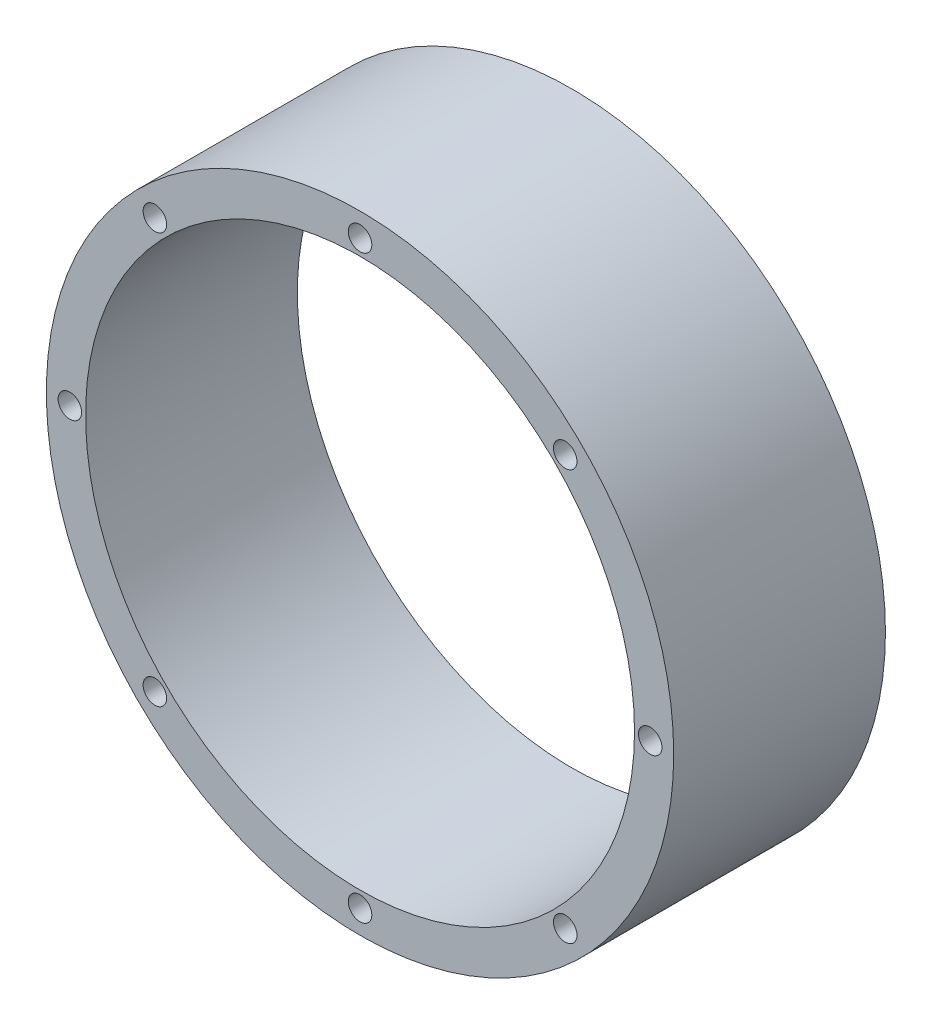
from build123d import *

# Parameters (mm, degrees)
SKETCH1_R                       = 40
SKETCH1_R_2                     = 35
BOSS_EXTRUDE1_DEPTH             = 27
F_3_0MM_DOWEL_HOLE1_D           = 3
F_3_0MM_DOWEL_HOLE1_CSINK_D     = 3.05
F_3_0MM_DOWEL_HOLE1_CSINK_ANGLE = 90


with BuildPart() as part:
    # Sketch1 → Boss-Extrude1 (new body)
    with BuildSketch(Plane.XY):
        Circle(SKETCH1_R)
        Circle(SKETCH1_R_2, mode=Mode.SUBTRACT)
    extrude(amount=BOSS_EXTRUDE1_DEPTH)

    # Ø3.0mm Dowel Hole1 (through all)
    with Locations(Plane(origin=(0, 0, 0), x_dir=(-1, 0, 0), z_dir=(0, 0, -1))):
        with Locations((0, 37), (26.162950904, 26.162950904), (37, 0), (-26.162950904, 26.162950904), (-37, 0), (-26.162950904, -26.162950904), (0, -37), (26.162950904, -26.162950904)):
            CounterSinkHole(F_3_0MM_DOWEL_HOLE1_D / 2, F_3_0MM_DOWEL_HOLE1_CSINK_D / 2, counter_sink_angle=F_3_0MM_DOWEL_HOLE1_CSINK_ANGLE)


solid = part.part
